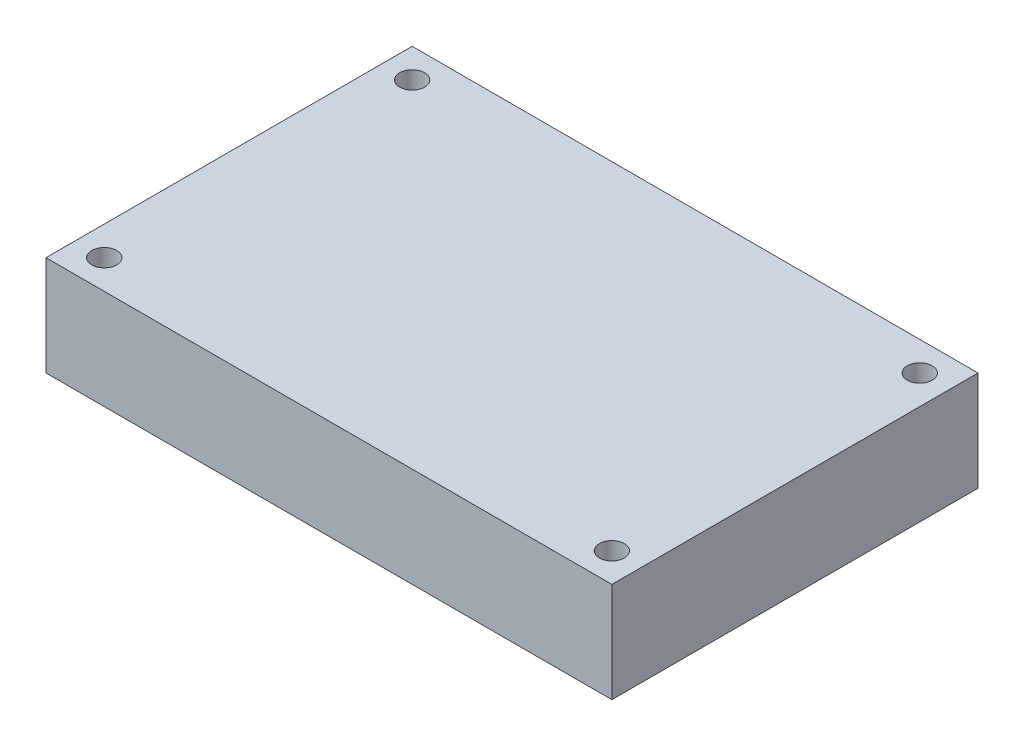
from build123d import *

# Parameters (mm, degrees)
SKETCH_1_W      = 68
SKETCH_1_H      = 44
SKETCH_1_R      = 1.5
EXTRUDE_1_DEPTH = 12


with BuildPart() as part:
    # 草图1 → 凸台-拉伸1 (new body)
    with BuildSketch(Plane(origin=(0, 0, 0), x_dir=(1, 0, 0), z_dir=(0, 1, 0))):
        Rectangle(SKETCH_1_W, SKETCH_1_H)
        with Locations(Location((-30.5, 18.5, 0), (0, 0, 270))):
            Circle(SKETCH_1_R, mode=Mode.SUBTRACT)
        with Locations(Location((-30.5, -18.5, 0), (0, 0, 270))):
            Circle(SKETCH_1_R, mode=Mode.SUBTRACT)
        with Locations(Location((30.5, -18.5, 0), (0, 0, 270))):
            Circle(SKETCH_1_R, mode=Mode.SUBTRACT)
        with Locations(Location((30.5, 18.5, 0), (0, 0, 270))):
            Circle(SKETCH_1_R, mode=Mode.SUBTRACT)
    extrude(amount=EXTRUDE_1_DEPTH)


solid = part.part
